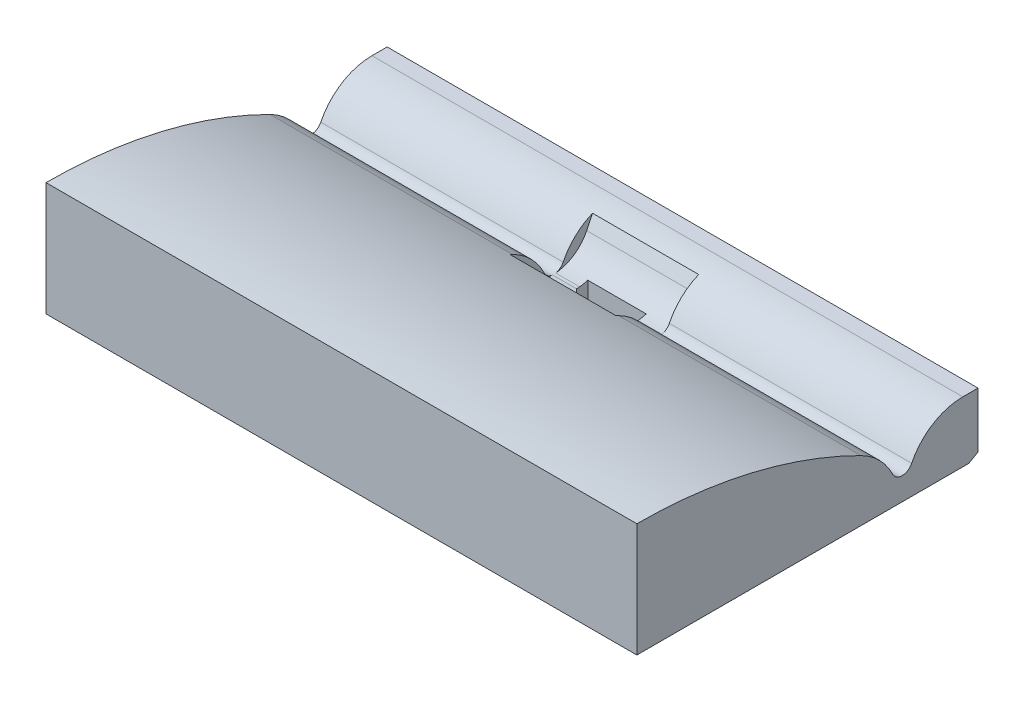
from build123d import *

# Parameters (mm, degrees)
EXTRUDE_1506_DEPTH      = 38.971143
EXTRUDE_1506_DEPTH_BACK = 38.971143
USB_REACH               = 62.065
CUT_EXTRUDE_2135_DEPTH  = 7


with BuildPart() as part:
    # Эскиз1 → Extrude 1506 (new, two sides: drawn at the far end of the back side and taken through both)
    with BuildSketch(Plane(origin=(0, 0, 0), x_dir=(0, 0, -1), z_dir=(1, 0, 0)).offset(-EXTRUDE_1506_DEPTH_BACK)):
        with BuildLine():
            Line((0, 60.5), (-2, 60.5))
            ThreePointArc((-2, 60.5), (-5.97996079, 59.358562264), (-8.75, 56.28125))
            ThreePointArc((-8.75, 56.28125), (-10, 55.5), (-11.25, 56.28125))
            ThreePointArc((-11.25, 56.28125), (-12.988798615, 58.733904838), (-15.421871621, 60.5))
            ThreePointArc((-15.421871621, 60.5), (-29.802420601, 65.726159332), (-45, 67.5))
            Line((-45, 67.5), (-45, 52.5))
            Line((-45, 52.5), (-1.212435565, 52.5))
            Line((-1.212435565, 52.5), (0, 53.2))
            Line((0, 53.2), (0, 60.5))
        make_face()
    extrude(amount=EXTRUDE_1506_DEPTH + EXTRUDE_1506_DEPTH_BACK)

    # Эскиз3 → Вырез под USB (cut, up to next)
    with BuildSketch(Plane(origin=(0, 60.5, 0), x_dir=(1, 0, 0), z_dir=(0, 1, 0)), mode=Mode.PRIVATE) as usb_sk1:
        Polygon((3.85, -8.65), (-3.85, -8.65), (-3.85, -10.15), (-2.65, -11.35), (2.65, -11.35), (3.85, -10.15), align=None)
    usb_tool1 = extrude(usb_sk1.sketch, amount=-USB_REACH, mode=Mode.PRIVATE) & part.part
    add(usb_tool1.solids().sort_by_distance((0, 60.5, 9.929302))[0], mode=Mode.SUBTRACT)

    # Эскиз4 → Cut-Extrude 2135 (cut, symmetric)
    with BuildSketch(Plane(origin=(0, 0, 0), x_dir=(0, 0, -1), z_dir=(1, 0, 0))):
        with BuildLine():
            Line((-5.65, 58.328664085), (-1.315214811, 67.278875413))
            Line((-1.315214811, 67.278875413), (-18.984785189, 67.278875413))
            Line((-18.984785189, 67.278875413), (-14.65, 58.328664085))
            ThreePointArc((-14.65, 58.328664085), (-10.15, 55.508113557), (-5.65, 58.328664085))
        make_face()
    extrude(amount=CUT_EXTRUDE_2135_DEPTH, both=True, mode=Mode.SUBTRACT)


solid = part.part
